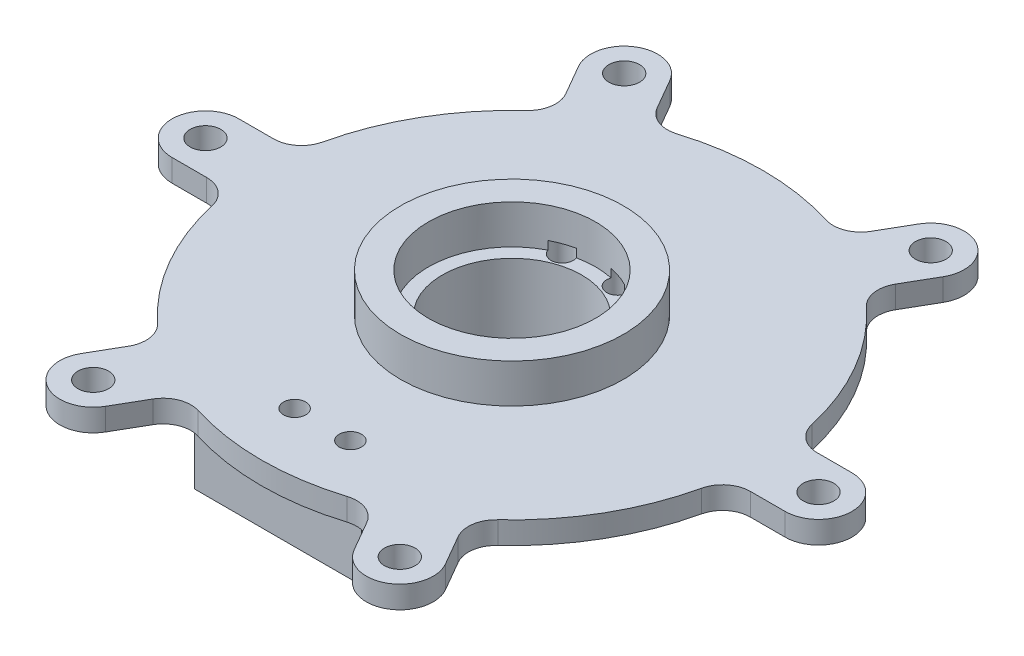
from build123d import *

# Parameters (mm, degrees)
SKETCH_1_R               = 20
SKETCH_1_R_2             = 15
EXTRUDE_1_DEPTH          = 7
SKETCH_2_R               = 70
SKETCH_2_R_2             = 12.5
EXTRUDE_2_DEPTH          = 4
SKETCH_3_W               = 30
SKETCH_3_H               = 64
SKETCH_3_R               = 2
SKETCH_3_R_2             = 12.5
EXTRUDE_3_DEPTH          = 9.5
SKETCH_4_R               = 80
SKETCH_4_R_2             = 45
CUT_EXTRUDE_1_DEPTH      = 9.5
CUT_EXTRUDE_START        = -15
SKETCH_6_R               = 2
CUT_EXTRUDE_2_DEPTH      = 15
SKETCH_7_R               = 2.75
EXTRUDE_4_DEPTH          = 4
PATTERN_CIRCULAR_1_COUNT = 6
FILLET_2_R               = 5


with BuildPart() as part:
    # Эскиз1 → Бобышка-Вытянуть1 (new body)
    with BuildSketch(Plane(origin=(0, 0, 0), x_dir=(1, 0, 0), z_dir=(0, 1, 0))):
        with Locations(Location((0, 0, 0), (0, 0, 270))):
            Circle(SKETCH_1_R)
        with Locations(Location((0, 0, 0), (0, 0, 270))):
            Circle(SKETCH_1_R_2, mode=Mode.SUBTRACT)
    extrude(amount=EXTRUDE_1_DEPTH)

    # Эскиз2 → Бобышка-Вытянуть2 (add)
    with BuildSketch(Plane.XZ):
        with Locations(Location((0, 0, 0), (0, 0, 270))):
            Circle(SKETCH_2_R)
        with Locations(Location((0, 0, 0), (0, 0, 270))):
            Circle(SKETCH_2_R_2, mode=Mode.SUBTRACT)
    extrude(amount=EXTRUDE_2_DEPTH)

    # Эскиз3 → Бобышка-Вытянуть3 (add)
    with BuildSketch(Plane.XZ.offset(4)):
        with Locations((0, 10)):
            Rectangle(SKETCH_3_W, SKETCH_3_H)
        with Locations(Location((-5, 34, 0), (0, 0, 270))):
            Circle(SKETCH_3_R, mode=Mode.SUBTRACT)
        with Locations(Location((5, 34, 0), (0, 0, 270))):
            Circle(SKETCH_3_R, mode=Mode.SUBTRACT)
        with Locations(Location((-5, -14, 0), (0, 0, 270))):
            Circle(SKETCH_3_R, mode=Mode.SUBTRACT)
        with Locations(Location((5, -14, 0), (0, 0, 270))):
            Circle(SKETCH_3_R, mode=Mode.SUBTRACT)
        with Locations(Location((0, 0, 0), (0, 0, 270))):
            Circle(SKETCH_3_R_2, mode=Mode.SUBTRACT)
    extrude(amount=EXTRUDE_3_DEPTH)

    # Эскиз4 → Вырез-Вытянуть1 (cut)
    with BuildSketch(Plane(origin=(0, 0, 0), x_dir=(1, 0, 0), z_dir=(0, 1, 0))):
        Circle(SKETCH_4_R)
        with Locations(Location((0, 0, 0), (0, 0, 270))):
            Circle(SKETCH_4_R_2, mode=Mode.SUBTRACT)
    extrude(amount=-CUT_EXTRUDE_1_DEPTH, mode=Mode.SUBTRACT)

    # Эскиз6 → Вырез-Вытянуть2 (cut)
    with BuildSketch(Plane.XZ.offset(13.5).offset(CUT_EXTRUDE_START)):
        with Locations(Location((-5, 34, 0), (0, 0, 270))):
            Circle(SKETCH_6_R)
        with Locations(Location((5, 34, 0), (0, 0, 270))):
            Circle(SKETCH_6_R)
        with Locations(Location((-5, -14, 0), (0, 0, 160.346175942))):
            Circle(SKETCH_6_R)
        with Locations(Location((5, -14, 0), (0, 0, 19.653824058))):
            Circle(SKETCH_6_R)
    extrude(amount=CUT_EXTRUDE_2_DEPTH, mode=Mode.SUBTRACT)

    # Эскиз7 → Бобышка-Вытянуть4 (add)
    with BuildSketch(Plane(origin=(0, 0, 0), x_dir=(1, 0, 0), z_dir=(0, 1, 0))):
        with BuildLine():
            Line((-55, 6), (-40, 6))
            Line((-40, 6), (-40, -6))
            Line((-40, -6), (-55, -6))
            ThreePointArc((-55, -6), (-61, 0), (-55, 6))
        make_face()
        with Locations(Location((-55, 0, 0), (0, 0, 270))):
            Circle(SKETCH_7_R, mode=Mode.SUBTRACT)
    extrude_4 = extrude(amount=-EXTRUDE_4_DEPTH)

    # Круговой массив1: Бобышка-Вытянуть4 ×6 about axis
    pattern_circular_1_axis = Axis((0, 0, 0), (0, 1, 0))
    for i in range(1, PATTERN_CIRCULAR_1_COUNT):
        add(extrude_4.rotate(pattern_circular_1_axis, i * 360 / PATTERN_CIRCULAR_1_COUNT))

    # Скругление2
    fillet_2_edges = [part.edges().sort_by_distance(p)[0] for p in [
        (-17.102950698, -2, 41.623179569),
        (-27.495255544, -2, 35.623179569),
        (27.495255544, -2, 35.623179569),
        (17.102950698, -2, 41.623179569),
        (44.598206242, -2, -6),
        (44.598206242, -2, 6),
        (17.102950698, -2, -41.623179569),
        (27.495255544, -2, -35.623179569),
        (-27.495255544, -2, -35.623179569),
        (-17.102950698, -2, -41.623179569),
        (-44.598206242, -2, 6),
        (-44.598206242, -2, -6),
    ]]
    fillet(fillet_2_edges, radius=FILLET_2_R)


solid = part.part
